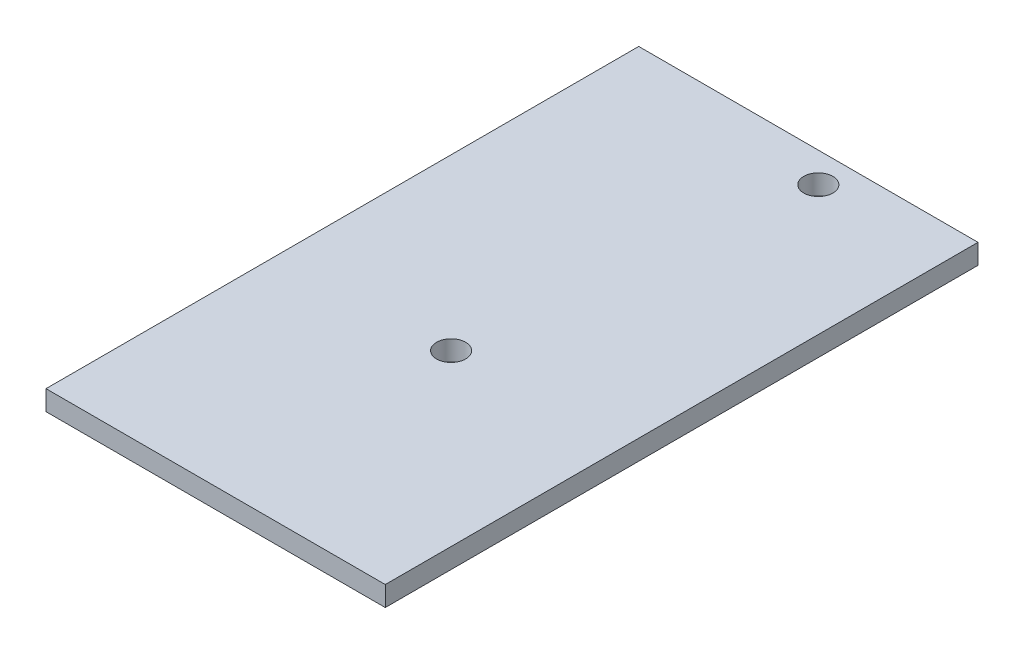
from build123d import *

# Parameters (mm, degrees)
SKETCH1_W                = 43.18
SKETCH1_H                = 75.438
BOSS_EXTRUDE1_DEPTH      = 2.54
M3_CLEARANCE_HOLE1_D     = 3.7
M3_CLEARANCE_HOLE1_DEPTH = 25.4
M3_CLEARANCE_HOLE1_TIP   = 1.111592145


with BuildPart() as part:
    # Sketch1 → Boss-Extrude1 (new body)
    with BuildSketch(Plane(origin=(0, 0, 0), x_dir=(1, 0, 0), z_dir=(0, 1, 0))):
        with Locations((-5.08, 5.461)):
            Rectangle(SKETCH1_W, SKETCH1_H)
    extrude(amount=BOSS_EXTRUDE1_DEPTH)

    # M3 Clearance Hole1
    with Locations(Plane(origin=(0, 2.54, 0), x_dir=(1, 0, 0), z_dir=(0, 1, 0))):
        with Locations((0, 39.37), (-5.08, -2.286)):
            Hole(M3_CLEARANCE_HOLE1_D / 2, depth=M3_CLEARANCE_HOLE1_DEPTH)
            with Locations((0, 0, -(M3_CLEARANCE_HOLE1_DEPTH + M3_CLEARANCE_HOLE1_TIP / 2))):  # 118° drill point
                Cone(0, M3_CLEARANCE_HOLE1_D / 2, M3_CLEARANCE_HOLE1_TIP, mode=Mode.SUBTRACT)


solid = part.part
